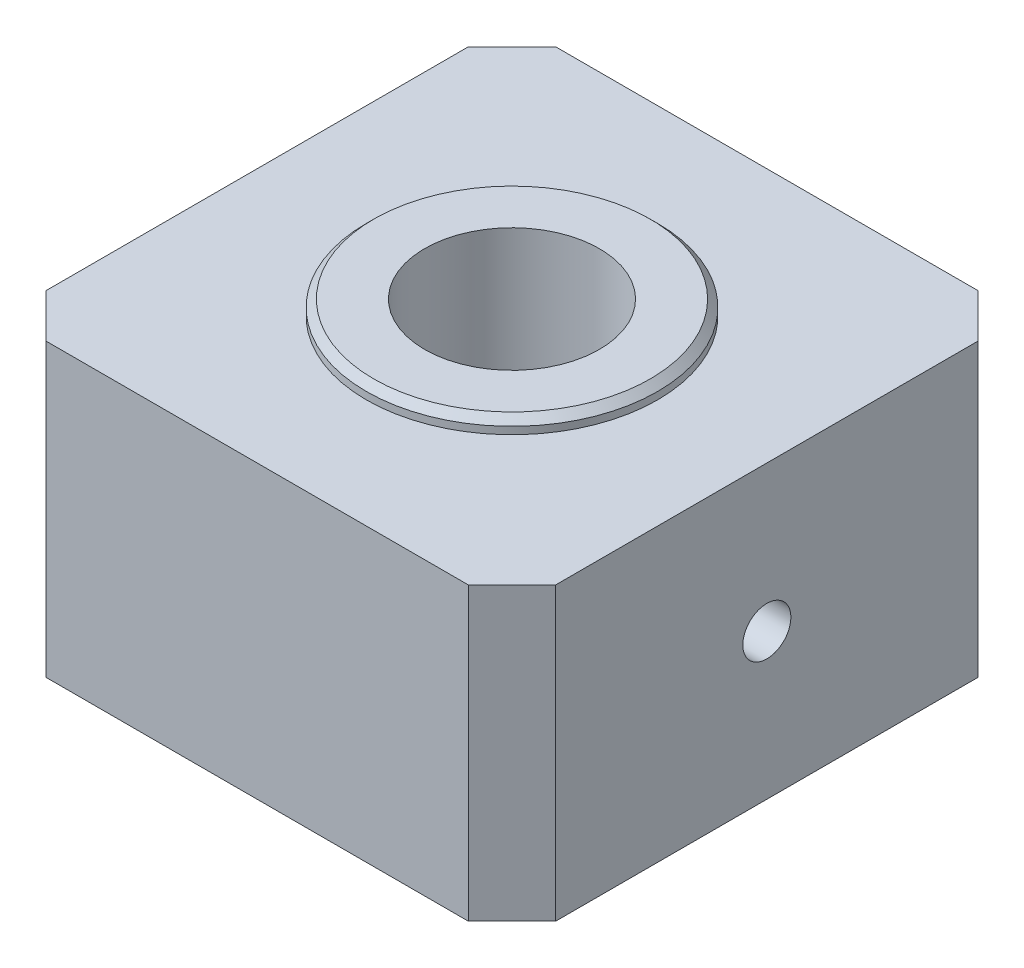
from build123d import *

# Parameters (mm, degrees)
SKETCH1_W              = 35
SKETCH1_H              = 35
BOSS_EXTRUDE1_DEPTH    = 20
SKETCH2_R              = 10
BOSS_EXTRUDE2_DEPTH    = 1
M14_TAPPED_HOLE1_D     = 12
M14_TAPPED_HOLE1_DEPTH = 14
M14_TAPPED_HOLE1_TIP   = 3.605163714
M4_TAPPED_HOLE1_D      = 3.3
M4_TAPPED_HOLE1_DEPTH  = 10.1
M4_TAPPED_HOLE1_TIP    = 0.991420021
M4_TAPPED_HOLE2_D      = 3.3
M4_TAPPED_HOLE2_DEPTH  = 9
M4_TAPPED_HOLE2_TIP    = 0.991420021
CHAMFER1_SIZE          = 3
CHAMFER2_SIZE          = 0.5


with BuildPart() as part:
    # Sketch1 → Boss-Extrude1 (new body)
    with BuildSketch(Plane(origin=(0, 0, 0), x_dir=(1, 0, 0), z_dir=(0, 1, 0))):
        Rectangle(SKETCH1_W, SKETCH1_H)
    extrude(amount=BOSS_EXTRUDE1_DEPTH)

    # Sketch2 → Boss-Extrude2 (add)
    with BuildSketch(Plane(origin=(0, 20, 0), x_dir=(1, 0, 0), z_dir=(0, 1, 0))):
        with Locations(Location((0, 0, 0), (0, 0, 270))):
            Circle(SKETCH2_R)
    extrude(amount=BOSS_EXTRUDE2_DEPTH)

    # M14 Tapped Hole1
    with Locations(Plane(origin=(0, 21, 0), x_dir=(1, 0, 0), z_dir=(0, 1, 0))):
        with Locations((0, 0)):
            Hole(M14_TAPPED_HOLE1_D / 2, depth=M14_TAPPED_HOLE1_DEPTH)
            with Locations((0, 0, -(M14_TAPPED_HOLE1_DEPTH + M14_TAPPED_HOLE1_TIP / 2))):  # 118° drill point
                Cone(0, M14_TAPPED_HOLE1_D / 2, M14_TAPPED_HOLE1_TIP, mode=Mode.SUBTRACT)

    # M4 Tapped Hole1
    with Locations(Plane(origin=(0, 0, 0), x_dir=(-1, 0, 0), z_dir=(0, -1, 0))):
        with Locations((-12.5, 12.5), (-12.5, -12.5), (12.5, -12.5), (12.5, 12.5)):
            Hole(M4_TAPPED_HOLE1_D / 2, depth=M4_TAPPED_HOLE1_DEPTH)
            with Locations((0, 0, -(M4_TAPPED_HOLE1_DEPTH + M4_TAPPED_HOLE1_TIP / 2))):  # 118° drill point
                Cone(0, M4_TAPPED_HOLE1_D / 2, M4_TAPPED_HOLE1_TIP, mode=Mode.SUBTRACT)

    # M4 Tapped Hole2
    with Locations(Plane(origin=(17.5, 0, 0), x_dir=(0, 0, -1), z_dir=(1, 0, 0))):
        with Locations((0, 10)):
            Hole(M4_TAPPED_HOLE2_D / 2, depth=M4_TAPPED_HOLE2_DEPTH)
            with Locations((0, 0, -(M4_TAPPED_HOLE2_DEPTH + M4_TAPPED_HOLE2_TIP / 2))):  # 118° drill point
                Cone(0, M4_TAPPED_HOLE2_D / 2, M4_TAPPED_HOLE2_TIP, mode=Mode.SUBTRACT)

    # Chamfer1
    chamfer1_edges = [part.edges().sort_by_distance(p)[0] for p in [
        (-17.5, 10, -17.5),
        (17.5, 10, -17.5),
        (17.5, 10, 17.5),
        (-17.5, 10, 17.5),
    ]]
    chamfer(chamfer1_edges, length=CHAMFER1_SIZE)

    # Chamfer2
    chamfer2_edges = [part.edges().sort_by_distance(p)[0] for p in [
        (0, 21, -10),
    ]]
    chamfer(chamfer2_edges, length=CHAMFER2_SIZE)


solid = part.part
